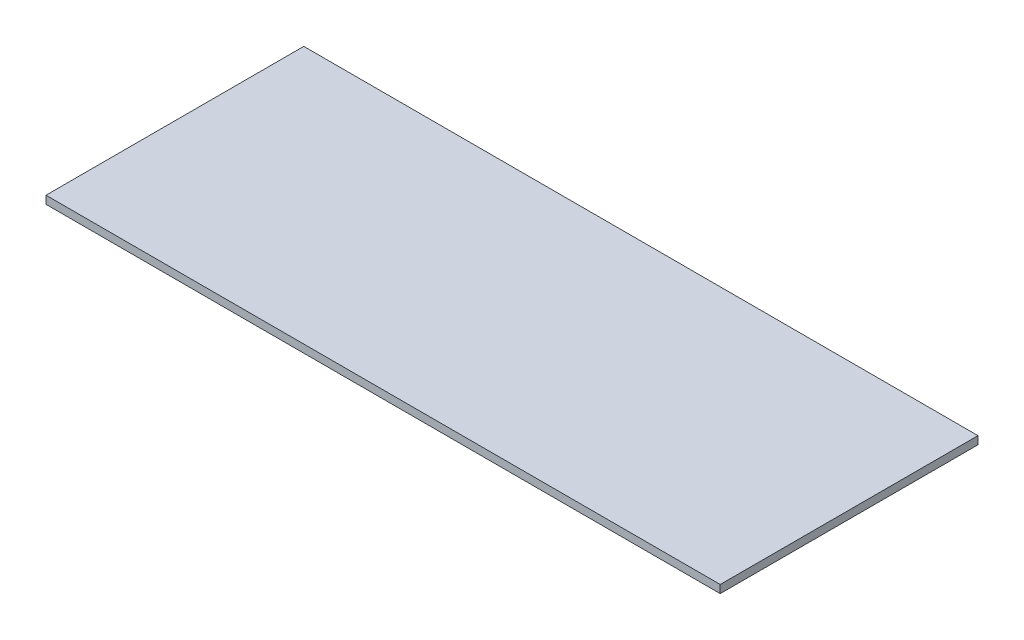
from build123d import *

# Parameters (mm, degrees)
SKETCH1_W           = 340
SKETCH1_H           = 130
BOSS_EXTRUDE1_DEPTH = 4


with BuildPart() as part:
    # Sketch1 → Boss-Extrude1 (new body)
    with BuildSketch(Plane(origin=(0, 71.8, 0), x_dir=(1, 0, 0), z_dir=(0, 1, 0))):
        with Locations((300, -345)):
            Rectangle(SKETCH1_W, SKETCH1_H)
    extrude(amount=BOSS_EXTRUDE1_DEPTH)


solid = part.part
